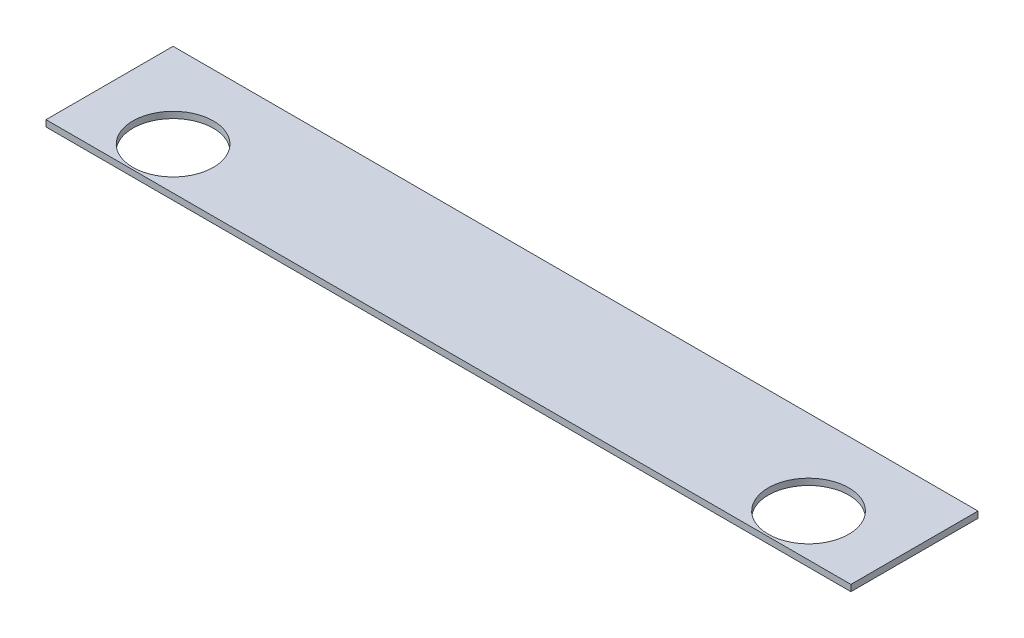
from build123d import *

# Parameters (mm, degrees)
SKETCH1_W           = 38
SKETCH1_H           = 6
SKETCH1_R           = 1.9
BOSS_EXTRUDE2_DEPTH = 0.3


with BuildPart() as part:
    # Sketch1 → Boss-Extrude2 (new body)
    with BuildSketch(Plane(origin=(0, 0, 0), x_dir=(1, 0, 0), z_dir=(0, 1, 0))):
        Rectangle(SKETCH1_W, SKETCH1_H)
        with Locations(Location((-15, -1, 0), (0, 0, 270))):
            Circle(SKETCH1_R, mode=Mode.SUBTRACT)
        with Locations(Location((15, -1, 0), (0, 0, 270))):
            Circle(SKETCH1_R, mode=Mode.SUBTRACT)
    extrude(amount=BOSS_EXTRUDE2_DEPTH)


solid = part.part
